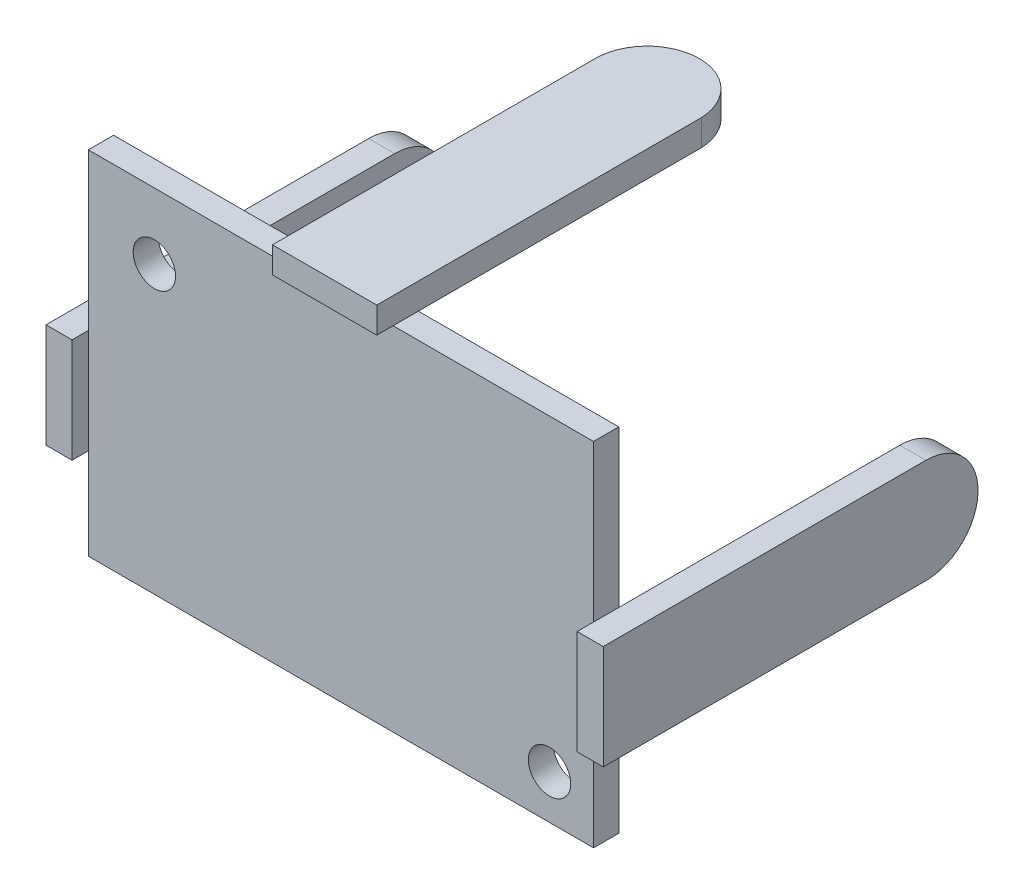
from build123d import *

# Parameters (mm, degrees)
SKETCH1_W           = 31
SKETCH1_H           = 21.6
SKETCH1_R           = 1.3
BOSS_EXTRUDE1_DEPTH = 1.55
BOSS_EXTRUDE2_START = 15.5
BOSS_EXTRUDE2_DEPTH = 1.6
BOSS_EXTRUDE3_START = -15.5
BOSS_EXTRUDE3_DEPTH = 1.6
BOSS_EXTRUDE4_DEPTH = 1.6


with BuildPart() as part:
    # Sketch1 → Boss-Extrude1 (new body)
    with BuildSketch(Plane.XY):
        Rectangle(SKETCH1_W, SKETCH1_H)
        with Locations(Location((12.8, -8.1, 0), (0, 0, 180))):
            Circle(SKETCH1_R, mode=Mode.SUBTRACT)
        with Locations(Location((-11.45, 6.75, 0), (0, 0, 180))):
            Circle(SKETCH1_R, mode=Mode.SUBTRACT)
    extrude(amount=BOSS_EXTRUDE1_DEPTH)

    # Sketch2<2> → Boss-Extrude3 (add)
    with BuildSketch(Plane(origin=(0, 0, 0), x_dir=(0, 0, -1), z_dir=(1, 0, 0)).offset(BOSS_EXTRUDE3_START)):
        with BuildLine():
            Line((-2.55, 1.2), (17.248963494, 1.2))
            ThreePointArc((17.248963494, 1.2), (20.449481705, -1.943435359), (17.364147134, -5.2))
            Line((17.364147134, -5.2), (-2.55, -5.2))
            Line((-2.55, -5.2), (-2.55, 1.2))
        make_face()
    extrude(amount=-BOSS_EXTRUDE3_DEPTH)

    # Sketch3 → Boss-Extrude4 (add)
    with BuildSketch(Plane(origin=(0, 10.8, 0), x_dir=(1, 0, 0), z_dir=(0, 1, 0))):
        with BuildLine():
            Line((-3.2, -2.55), (-3.2, 17.248963494))
            ThreePointArc((-3.2, 17.248963494), (-0.056564641, 20.449481705), (3.2, 17.364147134))
            Line((3.2, 17.364147134), (3.2, -2.55))
            Line((3.2, -2.55), (-3.2, -2.55))
        make_face()
    extrude(amount=BOSS_EXTRUDE4_DEPTH)


with BuildPart() as body_2:
    # Sketch2 → Boss-Extrude2 (new body)
    with BuildSketch(Plane(origin=(0, 0, 0), x_dir=(0, 0, -1), z_dir=(1, 0, 0)).offset(BOSS_EXTRUDE2_START)):
        with BuildLine():
            Line((-2.55, 1.2), (17.248963494, 1.2))
            ThreePointArc((17.248963494, 1.2), (20.449481705, -1.943435359), (17.364147134, -5.2))
            Line((17.364147134, -5.2), (-2.55, -5.2))
            Line((-2.55, -5.2), (-2.55, 1.2))
        make_face()
    extrude(amount=BOSS_EXTRUDE2_DEPTH)


solid = Compound([part.part, body_2.part])
